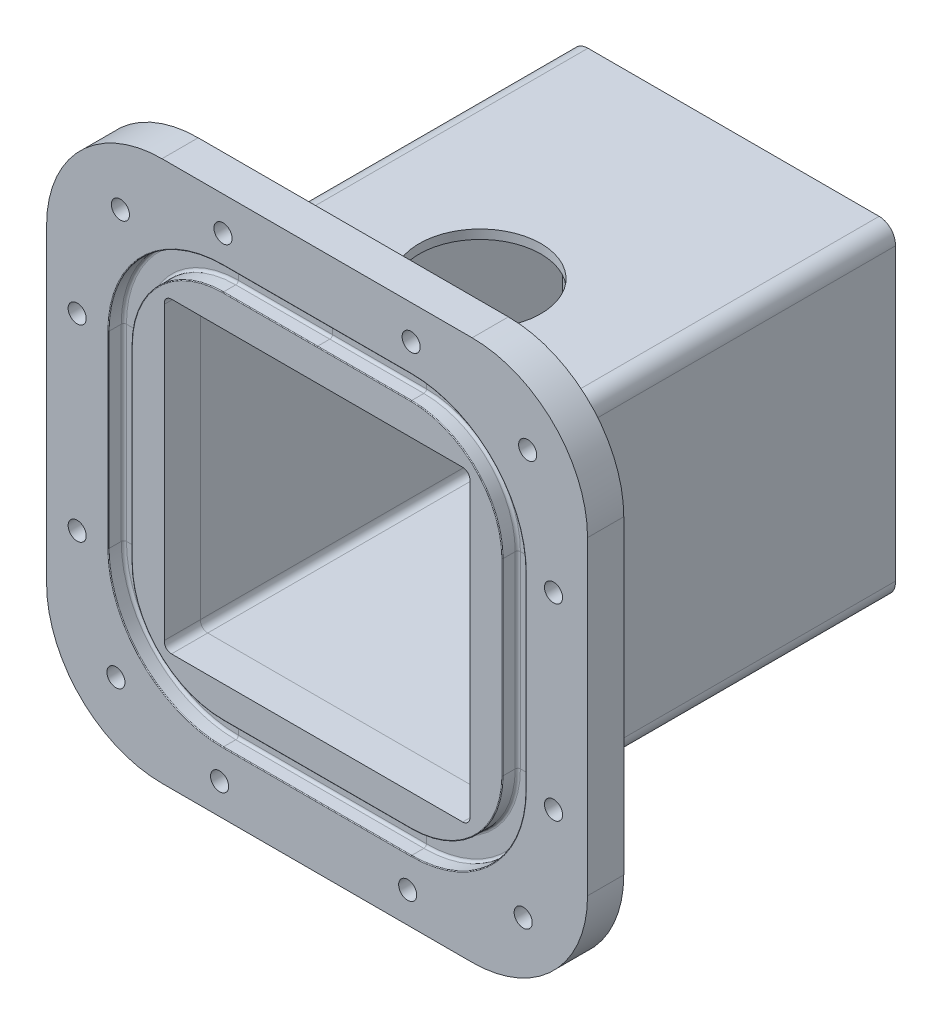
from build123d import *

# Parameters (mm, degrees)
BOSS_EXTRUDE1_DEPTH     = 63.5
BOSS_EXTRUDE2_START     = -63.5
SKETCH12_R              = 12.5
BOSS_EXTRUDE2_DEPTH     = 3.175
CUT_EXTRUDE6_DEPTH      = 78.875967383
CUT_EXTRUDE6_DEPTH_BACK = 55.458104
CUT_EXTRUDE6_START      = 28.522802
SKETCH18_R              = 10.668
BOSS_EXTRUDE3_DEPTH     = 6.35
CUT_EXTRUDE7_START      = 6.35
SKETCH10_R              = 1.5875
CUT_EXTRUDE7_DEPTH      = 69.85


with BuildPart() as part:
    # Sketch1 → Boss-Extrude1 (new body)
    with BuildSketch(Plane.XY):
        with BuildLine():
            Line((-25.524896918, 28.522801686), (25.524896918, 28.522801686))
            ThreePointArc((25.524896918, 28.522801686), (27.618653102, 27.609907376), (28.374611836, 25.454514751))
            Line((28.374611836, 25.454514751), (28.374611836, -25.454514751))
            ThreePointArc((28.374611836, -25.454514751), (27.618653102, -27.609907376), (25.524896918, -28.522801686))
            Line((25.524896918, -28.522801686), (-25.524896918, -28.522801686))
            ThreePointArc((-25.524896918, -28.522801686), (-27.618653102, -27.609907376), (-28.374611836, -25.454514751))
            Line((-28.374611836, -25.454514751), (-28.374611836, 25.454514751))
            ThreePointArc((-28.374611836, 25.454514751), (-27.618653102, 27.609907376), (-25.524896918, 28.522801686))
        make_face()
        with BuildLine():
            Line((-25.524896918, 26.935301686), (25.524896918, 26.935301686))
            ThreePointArc((25.524896918, 26.935301686), (26.471262084, 26.51223319), (26.787111836, 25.524896918))
            Line((26.787111836, 25.524896918), (26.787111836, -25.524896918))
            ThreePointArc((26.787111836, -25.524896918), (26.471262084, -26.51223319), (25.524896918, -26.935301686))
            Line((25.524896918, -26.935301686), (-25.524896918, -26.935301686))
            ThreePointArc((-25.524896918, -26.935301686), (-26.471262084, -26.51223319), (-26.787111836, -25.524896918))
            Line((-26.787111836, -25.524896918), (-26.787111836, 25.524896918))
            ThreePointArc((-26.787111836, 25.524896918), (-26.471262084, 26.51223319), (-25.524896918, 26.935301686))
        make_face(mode=Mode.SUBTRACT)
    extrude(amount=-BOSS_EXTRUDE1_DEPTH)

    # Sketch12 → Boss-Extrude2 (add)
    with BuildSketch(Plane.XY.offset(BOSS_EXTRUDE2_START)):
        with BuildLine():
            ThreePointArc((-25.524896918, 28.522801686), (-27.618653102, 27.609907376), (-28.374611836, 25.454514751))
            Line((-28.374611836, 25.454514751), (-28.374611836, -25.454514751))
            ThreePointArc((-28.374611836, -25.454514751), (-27.618653102, -27.609907376), (-25.524896918, -28.522801686))
            Line((-25.524896918, -28.522801686), (25.524896918, -28.522801686))
            ThreePointArc((25.524896918, -28.522801686), (27.618653102, -27.609907376), (28.374611836, -25.454514751))
            Line((28.374611836, -25.454514751), (28.374611836, 25.454514751))
            ThreePointArc((28.374611836, 25.454514751), (27.618653102, 27.609907376), (25.524896918, 28.522801686))
            Line((25.524896918, 28.522801686), (-25.524896918, 28.522801686))
        make_face()
        Circle(SKETCH12_R, mode=Mode.SUBTRACT)
    extrude(amount=-BOSS_EXTRUDE2_DEPTH)

    # Sketch18 → Cut-Extrude6 (cut, two sides: drawn at the far end of the back side and taken through both)
    with BuildSketch(Plane(origin=(0, 0, 0), x_dir=(1, 0, 0), z_dir=(0, 1, 0)).offset(CUT_EXTRUDE6_START - CUT_EXTRUDE6_DEPTH_BACK)):
        with Locations(Location((0, 22.225, 0), (0, 0, 90))):
            Circle(SKETCH18_R)
    extrude(amount=CUT_EXTRUDE6_DEPTH + CUT_EXTRUDE6_DEPTH_BACK, mode=Mode.SUBTRACT)


with BuildPart() as body_2:
    # Sketch19 → Boss-Extrude3 (new body)
    with BuildSketch(Plane.XY):
        with BuildLine():
            Line((-27.193511836, -47.424611836), (27.193511836, -47.424611836))
            ThreePointArc((27.193511836, -47.424611836), (41.499059837, -41.499059837), (47.424611836, -27.193511836))
            Line((47.424611836, -27.193511836), (47.424611836, 27.193511836))
            ThreePointArc((47.424611836, 27.193511836), (41.499059837, 41.499059837), (27.193511836, 47.424611836))
            Line((27.193511836, 47.424611836), (-27.193511836, 47.424611836))
            ThreePointArc((-27.193511836, 47.424611836), (-41.499059837, 41.499059837), (-47.424611836, 27.193511836))
            Line((-47.424611836, 27.193511836), (-47.424611836, -27.193511836))
            ThreePointArc((-47.424611836, -27.193511836), (-41.499059837, -41.499059837), (-27.193511836, -47.424611836))
        make_face()
        with BuildLine():
            Line((26.787111836, -25.524896918), (26.787111836, 25.524896918))
            ThreePointArc((26.787111836, 25.524896918), (26.471262084, 26.51223319), (25.524896918, 26.935301686))
            Line((25.524896918, 26.935301686), (-25.524896918, 26.935301686))
            ThreePointArc((-25.524896918, 26.935301686), (-26.471262084, 26.51223319), (-26.787111836, 25.524896918))
            Line((-26.787111836, 25.524896918), (-26.787111836, -25.524896918))
            ThreePointArc((-26.787111836, -25.524896918), (-26.471262084, -26.51223319), (-25.524896918, -26.935301686))
            Line((-25.524896918, -26.935301686), (25.524896918, -26.935301686))
            ThreePointArc((25.524896918, -26.935301686), (26.471262084, -26.51223319), (26.787111836, -25.524896918))
        make_face(mode=Mode.SUBTRACT)
    extrude(amount=BOSS_EXTRUDE3_DEPTH)

    # Cut-Sweep1: sweep along a path in Sketch11
    with BuildLine(Plane.XY.offset(6.35)) as cut_sweep1_path:
        Line((-16.492240366, -32.379940366), (16.492240366, -32.379940366))
        ThreePointArc((16.492240366, -32.379940366), (27.726540774, -27.726540774), (32.379940366, -16.492240366))
        Line((32.379940366, -16.492240366), (32.379940366, 16.492240366))
        ThreePointArc((32.379940366, 16.492240366), (27.726540774, 27.726540774), (16.492240366, 32.379940366))
        Line((16.492240366, 32.379940366), (-16.492240366, 32.379940366))
        ThreePointArc((-16.492240366, 32.379940366), (-27.726540774, 27.726540774), (-32.379940366, 16.492240366))
        Line((-32.379940366, 16.492240366), (-32.379940366, -16.492240366))
        ThreePointArc((-32.379940366, -16.492240366), (-27.726540774, -27.726540774), (-16.492240366, -32.379940366))
    # Sketch17 → Cut-Sweep1 (sweep, cut)
    with BuildSketch(Plane(origin=(0, 0, 0), x_dir=(0, 0, -1), z_dir=(1, 0, 0))):
        with BuildLine():
            Line((-6.223, 32.506940366), (-4.1148, 32.506940366))
            ThreePointArc((-4.1148, 32.506940366), (-3.79151078, 32.640851146), (-3.6576, 32.964140366))
            Line((-3.6576, 32.964140366), (-3.6576, 36.113740366))
            ThreePointArc((-3.6576, 36.113740366), (-3.79151078, 36.437029587), (-4.1148, 36.570940366))
            Line((-4.1148, 36.570940366), (-6.223, 36.570940366))
            ThreePointArc((-6.223, 36.570940366), (-6.312802561, 36.608137805), (-6.35, 36.697940366))
            Line((-6.35, 36.697940366), (-6.35, 32.379940366))
            ThreePointArc((-6.35, 32.379940366), (-6.312802561, 32.469742928), (-6.223, 32.506940366))
        make_face()
    sweep(path=cut_sweep1_path.line, mode=Mode.SUBTRACT)

    # Sketch10 → Cut-Extrude7 (cut)
    with BuildSketch(Plane.XY.offset(CUT_EXTRUDE7_START)):
        with Locations(Location((-35.262984871, -35.352922089, 0), (0, 0, 180))):
            Circle(SKETCH10_R)
        with Locations(Location((-34.476463114, 36.049506627, 0), (0, 0, 180))):
            Circle(SKETCH10_R)
        with Locations(Location((36.925965603, 35.262984871, 0), (0, 0, 180))):
            Circle(SKETCH10_R)
        with Locations(Location((-42.061276101, -16.492240366, 0), (0, 0, 180))):
            Circle(SKETCH10_R)
        with Locations(Location((36.139443846, -36.139443846, 0), (0, 0, 180))):
            Circle(SKETCH10_R)
        with Locations(Location((-42.061276101, 16.492240366, 0), (0, 0, 180))):
            Circle(SKETCH10_R)
        with Locations(Location((16.492240366, 41.460741539, 0), (0, 0, 180))):
            Circle(SKETCH10_R)
        with Locations(Location((-16.492240366, 41.460741539, 0), (0, 0, 180))):
            Circle(SKETCH10_R)
        with Locations(Location((41.460741539, -17.092774929, 0), (0, 0, 180))):
            Circle(SKETCH10_R)
        with Locations(Location((41.460741539, 15.891705804, 0), (0, 0, 180))):
            Circle(SKETCH10_R)
        with Locations(Location((-17.092774929, -42.061276101, 0), (0, 0, 180))):
            Circle(SKETCH10_R)
        with Locations(Location((15.891705804, -42.061276101, 0), (0, 0, 180))):
            Circle(SKETCH10_R)
    extrude(amount=-CUT_EXTRUDE7_DEPTH, mode=Mode.SUBTRACT)


solid = Compound([part.part, body_2.part])
